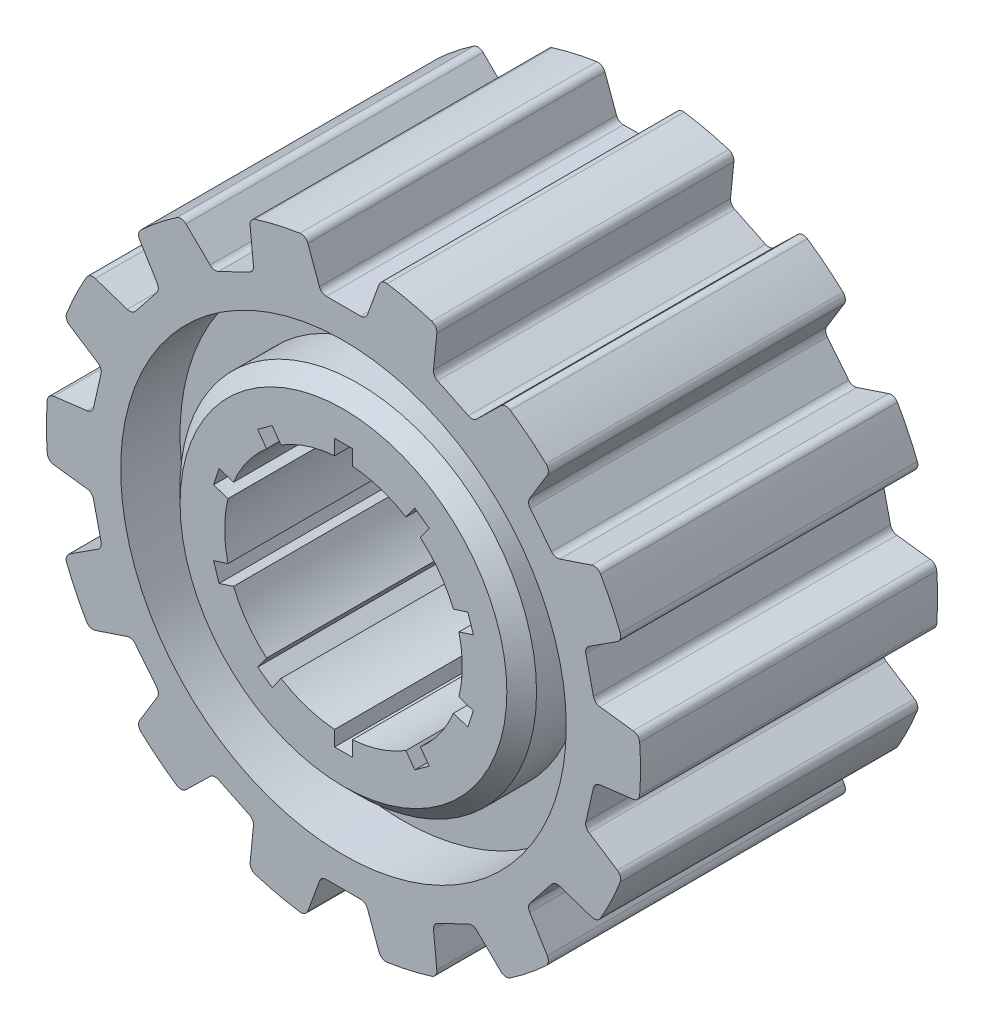
from build123d import *

# Parameters (mm, degrees)
SKETCH1_R           = 10
BOSS_EXTRUDE1_DEPTH = 5
CUT_EXTRUDE2_START  = 18.320508076
CUT_EXTRUDE2_DEPTH  = 28.320508076
CIRPATTERN1_COUNT   = 14
SKETCH3_R           = 7.5
SKETCH3_R_2         = 6
CUT_EXTRUDE3_DEPTH  = 2
CHAMFER1_SIZE       = 0.5
FILLET1_R           = 0.25


with BuildPart() as part:
    # Sketch1 → Boss-Extrude1 (new, symmetric)
    with BuildSketch(Plane.XY):
        Circle(SKETCH1_R)
        with BuildLine():
            Line((2.402328537, 3.81691205), (2.101814002, 3.403289277))
            ThreePointArc((2.101814002, 3.403289277), (1.236067977, 3.804226065), (0.3, 3.988734135))
            Line((0.3, 3.988734135), (0.3, 4.5))
            Line((0.3, 4.5), (-0.3, 4.5))
            Line((-0.3, 4.5), (-0.3, 3.988734135))
            ThreePointArc((-0.3, 3.988734135), (-1.236067977, 3.804226065), (-2.101814002, 3.403289277))
            Line((-2.101814002, 3.403289277), (-2.402328537, 3.81691205))
            Line((-2.402328537, 3.81691205), (-2.887738734, 3.464240899))
            Line((-2.887738734, 3.464240899), (-2.587224198, 3.050618126))
            ThreePointArc((-2.587224198, 3.050618126), (-3.236067977, 2.351141009), (-3.700806493, 1.517903589))
            Line((-3.700806493, 1.517903589), (-4.187049225, 1.67589343))
            Line((-4.187049225, 1.67589343), (-4.372459422, 1.10525952))
            Line((-4.372459422, 1.10525952), (-3.886216689, 0.947269679))
            ThreePointArc((-3.886216689, 0.947269679), (-4, 0), (-3.886216689, -0.947269679))
            Line((-3.886216689, -0.947269679), (-4.372459422, -1.10525952))
            Line((-4.372459422, -1.10525952), (-4.187049225, -1.67589343))
            Line((-4.187049225, -1.67589343), (-3.700806493, -1.517903589))
            ThreePointArc((-3.700806493, -1.517903589), (-3.236067977, -2.351141009), (-2.587224198, -3.050618126))
            Line((-2.587224198, -3.050618126), (-2.887738734, -3.464240899))
            Line((-2.887738734, -3.464240899), (-2.402328537, -3.81691205))
            Line((-2.402328537, -3.81691205), (-2.101814002, -3.403289277))
            ThreePointArc((-2.101814002, -3.403289277), (-1.236067977, -3.804226065), (-0.3, -3.988734135))
            Line((-0.3, -3.988734135), (-0.3, -4.5))
            Line((-0.3, -4.5), (0.3, -4.5))
            Line((0.3, -4.5), (0.3, -3.988734135))
            ThreePointArc((0.3, -3.988734135), (1.236067977, -3.804226065), (2.101814002, -3.403289277))
            Line((2.101814002, -3.403289277), (2.402328537, -3.81691205))
            Line((2.402328537, -3.81691205), (2.887738734, -3.464240899))
            Line((2.887738734, -3.464240899), (2.587224198, -3.050618126))
            ThreePointArc((2.587224198, -3.050618126), (3.236067977, -2.351141009), (3.700806493, -1.517903589))
            Line((3.700806493, -1.517903589), (4.187049225, -1.67589343))
            Line((4.187049225, -1.67589343), (4.372459422, -1.10525952))
            Line((4.372459422, -1.10525952), (3.886216689, -0.947269679))
            ThreePointArc((3.886216689, -0.947269679), (4, 0), (3.886216689, 0.947269679))
            Line((3.886216689, 0.947269679), (4.372459422, 1.10525952))
            Line((4.372459422, 1.10525952), (4.187049225, 1.67589343))
            Line((4.187049225, 1.67589343), (3.700806493, 1.517903589))
            ThreePointArc((3.700806493, 1.517903589), (3.236067977, 2.351141009), (2.587224198, 3.050618126))
            Line((2.587224198, 3.050618126), (2.887738734, 3.464240899))
            Line((2.887738734, 3.464240899), (2.402328537, 3.81691205))
        make_face(mode=Mode.SUBTRACT)
    extrude(amount=BOSS_EXTRUDE1_DEPTH, both=True)

    # Sketch2 → Cut-Extrude2 (cut)
    with BuildSketch(Plane.XY.offset(5).offset(CUT_EXTRUDE2_START)):
        with BuildLine():
            Line((0, 10), (0, 8.5))
            Line((0, 8.5), (0.75, 8.5))
            Line((0.75, 8.5), (1.266640021, 9.919456792))
            ThreePointArc((1.266640021, 9.919456792), (0.634599116, 9.979843885), (0, 10))
        make_face()
        with BuildLine():
            Line((-0.75, 8.5), (0, 8.5))
            Line((0, 8.5), (0, 10))
            ThreePointArc((0, 10), (-0.634599116, 9.979843885), (-1.266640021, 9.919456792))
            Line((-1.266640021, 9.919456792), (-0.75, 8.5))
        make_face()
    cut_extrude2 = extrude(amount=-CUT_EXTRUDE2_DEPTH, mode=Mode.SUBTRACT)

    # CirPattern1: Cut-Extrude2 ×14 about axis
    cirpattern1_axis = Axis((0, 0, 0), (0, 0, 1))
    for i in range(1, CIRPATTERN1_COUNT):
        add(cut_extrude2.rotate(cirpattern1_axis, i * 360 / CIRPATTERN1_COUNT), mode=Mode.SUBTRACT)

    # Sketch3 → Cut-Extrude3 (cut)
    with BuildSketch(Plane.XY.offset(5)):
        Circle(SKETCH3_R)
        Circle(SKETCH3_R_2, mode=Mode.SUBTRACT)
    cut_extrude3 = extrude(amount=-CUT_EXTRUDE3_DEPTH, mode=Mode.SUBTRACT)

    # Mirror1: Cut-Extrude3 across plane
    add(cut_extrude3.mirror(Plane.XY), mode=Mode.SUBTRACT)

    # Chamfer1
    chamfer1_edges = [part.edges().sort_by_distance(p)[0] for p in [
        (-6, 0, 5),
        (-6, 0, -5),
    ]]
    chamfer(chamfer1_edges, length=CHAMFER1_SIZE)

    # Fillet1
    fillet1_edges = [part.edges().sort_by_distance(p)[0] for p in [
        (-7.113184952, 4.713289704, 0),
        (-6.17795025, 5.886036928, 0),
        (-6.965606473, 7.174979196, 0),
        (-4.363738433, 7.332822573, 0),
        (-3.012285132, 7.983648182, 0),
        (-3.162687777, 9.486696265, 0),
        (-1.266640021, 9.919456792, 0),
        (-0.75, 8.5, 0),
        (0.75, 8.5, 0),
        (1.266640021, 9.919456792, 0),
        (3.162687777, 9.486696265, 0),
        (3.012285132, 7.983648182, 0),
        (4.363738433, 7.332822573, 0),
        (5.445094229, 8.387547248, 0),
        (6.965606473, 7.174979196, 0),
        (6.17795025, 5.886036928, 0),
        (7.113184952, 4.713289704, 0),
        (8.545080745, 5.194381104, 0),
        (9.38890138, 3.442169501, 0),
        (8.119996553, 2.622623873, 0),
        (8.453777954, 1.160232004, 0),
        (9.952609221, 0.972404078, 0),
        (9.952609221, -0.972404078, 0),
        (8.453777954, -1.160232004, 0),
        (8.119996553, -2.622623873, 0),
        (9.38890138, -3.442169501, 0),
        (8.545080745, -5.194381104, 0),
        (7.113184952, -4.713289704, 0),
        (6.17795025, -5.886036928, 0),
        (6.965606473, -7.174979196, 0),
        (5.445094229, -8.387547248, 0),
        (4.363738433, -7.332822573, 0),
        (3.012285132, -7.983648182, 0),
        (3.162687777, -9.486696265, 0),
        (1.266640021, -9.919456792, 0),
        (0.75, -8.5, 0),
        (-0.75, -8.5, 0),
        (-1.266640021, -9.919456792, 0),
        (-3.162687777, -9.486696265, 0),
        (-3.012285132, -7.983648182, 0),
        (-4.363738433, -7.332822573, 0),
        (-5.445094229, -8.387547248, 0),
        (-6.965606473, -7.174979196, 0),
        (-6.17795025, -5.886036928, 0),
        (-7.113184952, -4.713289704, 0),
        (-8.545080745, -5.194381104, 0),
        (-9.38890138, -3.442169501, 0),
        (-8.119996553, -2.622623873, 0),
        (-8.453777954, -1.160232004, 0),
        (-9.952609221, -0.972404078, 0),
        (-9.952609221, 0.972404078, 0),
        (-8.453777954, 1.160232004, 0),
        (-8.119996553, 2.622623873, 0),
        (-9.38890138, 3.442169501, 0),
        (-8.545080745, 5.194381104, 0),
        (-5.445094229, 8.387547248, 0),
    ]]
    fillet(fillet1_edges, radius=FILLET1_R)


solid = part.part
